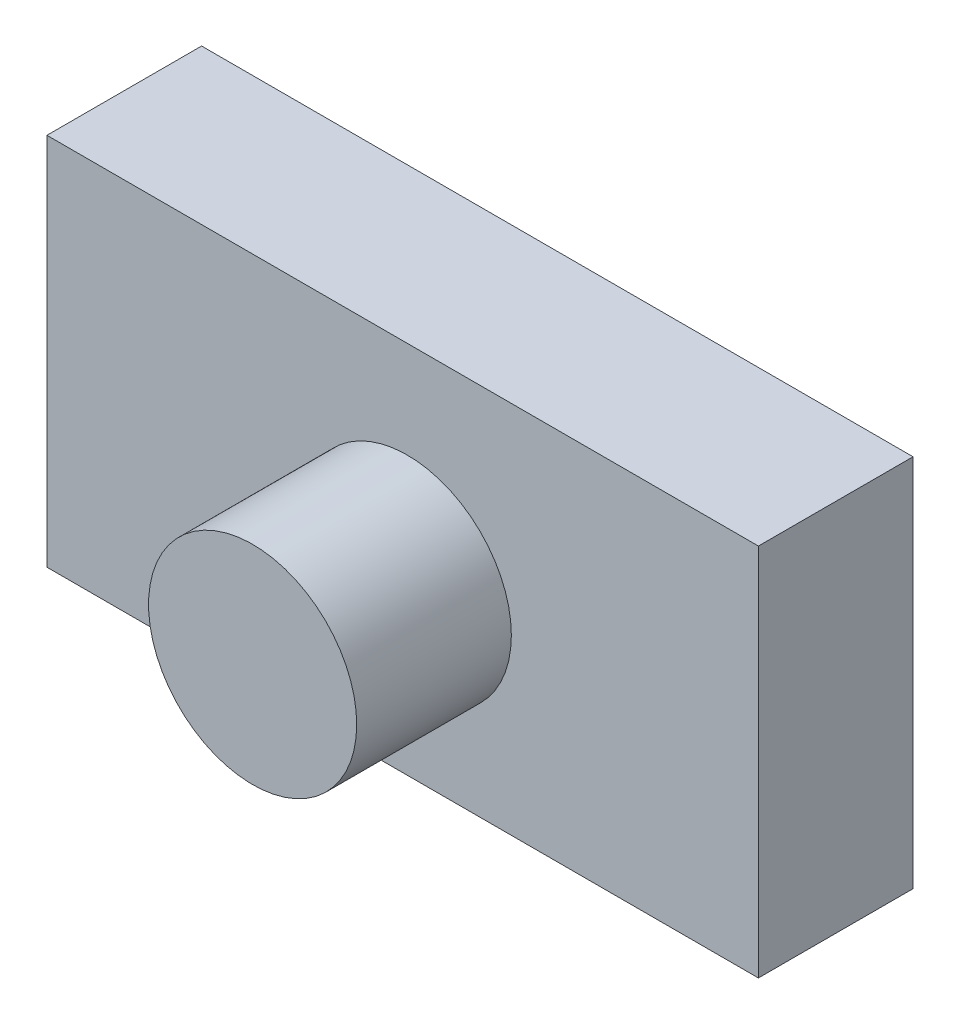
from build123d import *

# Parameters (mm, degrees)
SKETCH1_W           = 96.613496933
SKETCH1_H           = 50.8
BOSS_EXTRUDE1_DEPTH = 21
SKETCH4_R           = 14.134180844
BOSS_EXTRUDE2_DEPTH = 21


with BuildPart() as part:
    # Sketch1 → Boss-Extrude1 (new body)
    with BuildSketch(Plane.XY):
        with Locations((-0.623312883, 1.86993865)):
            Rectangle(SKETCH1_W, SKETCH1_H)
    extrude(amount=BOSS_EXTRUDE1_DEPTH)

    # Sketch4 → Boss-Extrude2 (add)
    with BuildSketch(Plane.XY.offset(21)):
        Circle(SKETCH4_R)
    extrude(amount=BOSS_EXTRUDE2_DEPTH)


solid = part.part
